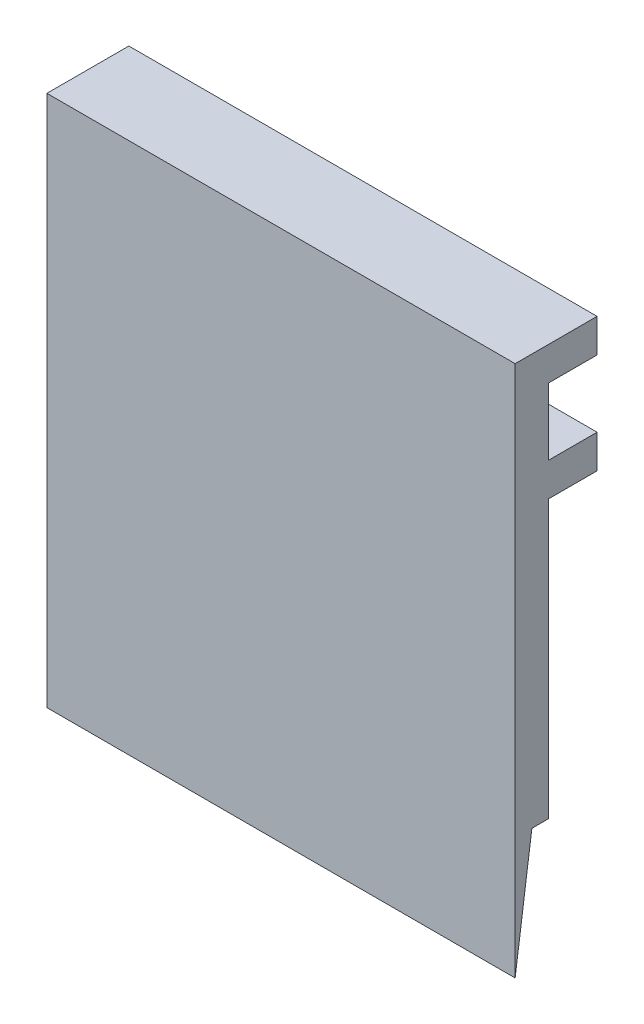
from build123d import *

# Parameters (mm, degrees)
SKETCH1_W           = 27.99800038
SKETCH1_H           = 2
BOSS_EXTRUDE1_DEPTH = 10
CUT_EXTRUDE1_DEPTH  = 32
SKETCH4_W           = 27.99800038
SKETCH4_H           = 2
BOSS_EXTRUDE2_DEPTH = 22.81231465
SKETCH5_W           = 4.9
SKETCH5_H           = 2
BOSS_EXTRUDE3_DEPTH = 27.99800038


with BuildPart() as part:
    # Sketch1 → Boss-Extrude1 (new body)
    with BuildSketch(Plane(origin=(0, 0, 0), x_dir=(1, 0, 0), z_dir=(0, 1, 0))):
        with Locations((13.99900019, 1)):
            Rectangle(SKETCH1_W, SKETCH1_H)
    extrude(amount=BOSS_EXTRUDE1_DEPTH)

    # Sketch3 → Cut-Extrude1 (cut)
    with BuildSketch(Plane(origin=(27.99800038, 0, 0), x_dir=(0, 0, -1), z_dir=(1, 0, 0))):
        Polygon((1, 8.25), (2, 8.25), (2, 0), (0, 0), (0, 1), align=None)
    extrude(amount=-CUT_EXTRUDE1_DEPTH, mode=Mode.SUBTRACT)

    # Sketch4 → Boss-Extrude2 (add)
    with BuildSketch(Plane(origin=(0, 10, 0), x_dir=(1, 0, 0), z_dir=(0, 1, 0))):
        with Locations((13.99900019, 1)):
            Rectangle(SKETCH4_W, SKETCH4_H)
    extrude(amount=BOSS_EXTRUDE2_DEPTH)

    # Sketch5 → Boss-Extrude3 (add)
    with BuildSketch(Plane(origin=(27.99800038, 0, 0), x_dir=(0, 0, -1), z_dir=(1, 0, 0))):
        with Locations((2.45, 31.81231465)):
            Rectangle(SKETCH5_W, SKETCH5_H)
        with Locations((2.45, 25.81231465)):
            Rectangle(SKETCH5_W, SKETCH5_H)
    extrude(amount=-BOSS_EXTRUDE3_DEPTH)


solid = part.part
